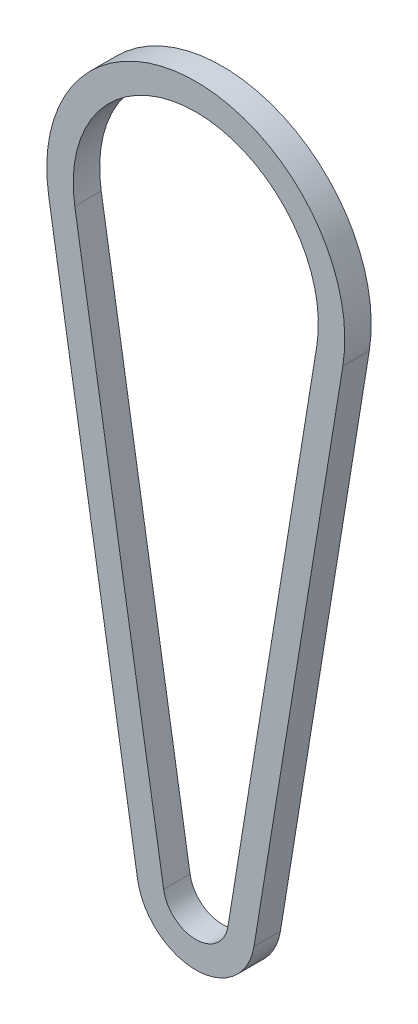
from build123d import *

# Parameters (mm, degrees)
BOSS_EXTRUDE1_DEPTH = 10.16


with BuildPart() as part:
    # Sketch1 → Boss-Extrude1 (new body)
    with BuildSketch(Plane.XY):
        with BuildLine():
            Line((56.548903869, 206.716798088), (22.388903194, -3.635823235))
            ThreePointArc((22.388903194, -3.635823235), (0, -22.6822), (-22.388903194, -3.635823235))
            Line((-22.388903194, -3.635823235), (-56.548903869, 206.716798088))
            ThreePointArc((-56.548903869, 206.716798088), (0, 273.1897), (56.548903869, 206.716798088))
        make_face()
        with BuildLine():
            Line((46.520279817, 208.345386324), (12.360279143, -2.007235))
            ThreePointArc((12.360279143, -2.007235), (0, -12.5222), (-12.360279143, -2.007235))
            Line((-12.360279143, -2.007235), (-46.520279817, 208.345386324))
            ThreePointArc((-46.520279817, 208.345386324), (0, 263.0297), (46.520279817, 208.345386324))
        make_face(mode=Mode.SUBTRACT)
    extrude(amount=BOSS_EXTRUDE1_DEPTH)


solid = part.part
